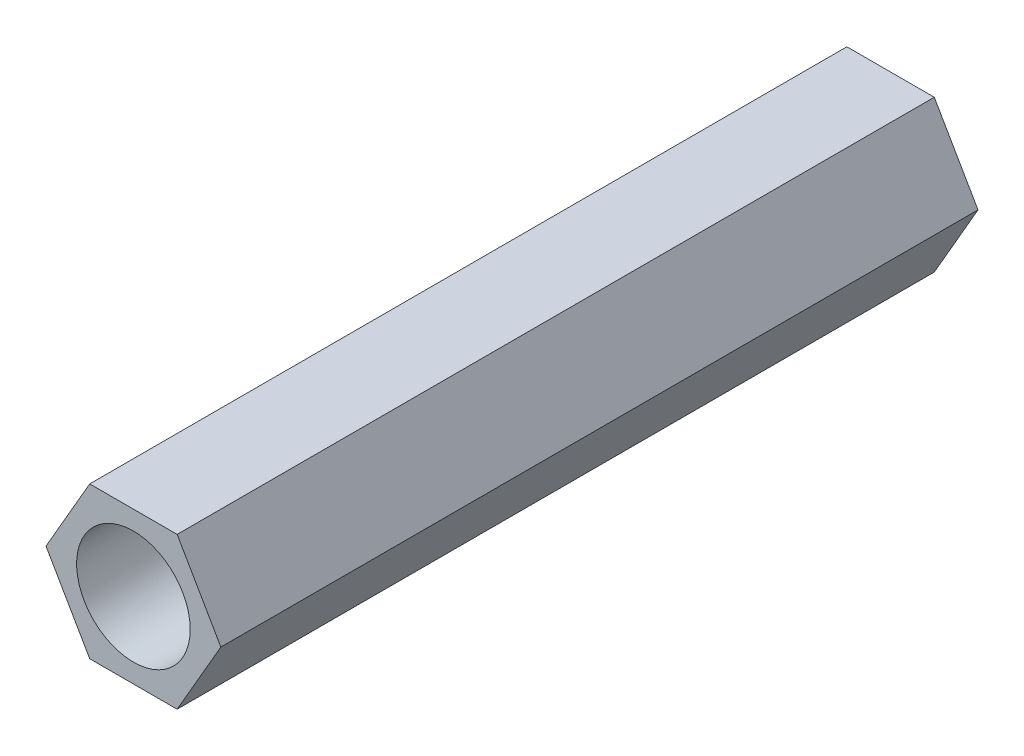
from build123d import *

# Parameters (mm, degrees)
SKETCH_1_R      = 1.5
EXTRUDE_1_DEPTH = 20


with BuildPart() as part:
    # 草图1 → 凸台-拉伸1 (new body)
    with BuildSketch(Plane.XY):
        Polygon((2.309401077, 0), (1.154700538, 2), (-1.154700538, 2), (-2.309401077, 0), (-1.154700538, -2), (1.154700538, -2), align=None)
        Circle(SKETCH_1_R, mode=Mode.SUBTRACT)
    extrude(amount=EXTRUDE_1_DEPTH)


solid = part.part
